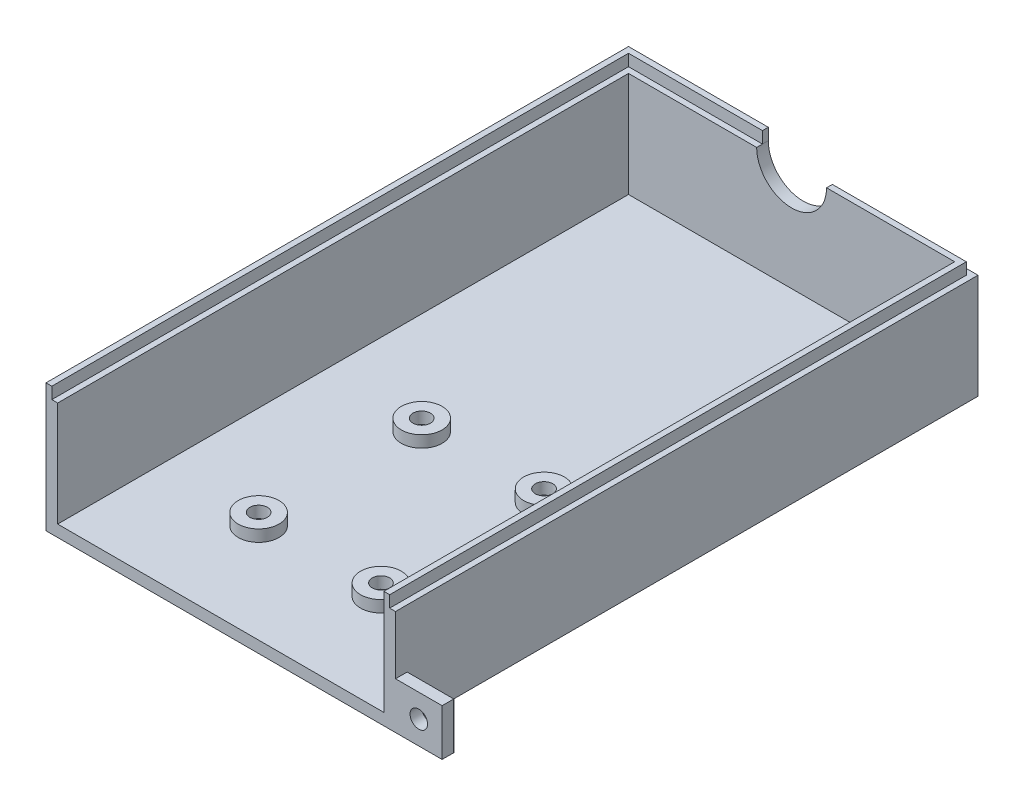
from build123d import *

# Parameters (mm, degrees)
SKETCH3_W           = 60
SKETCH3_H           = 100
BOSS_EXTRUDE1_DEPTH = 40
SHELL1_T            = -2
SKETCH2_R           = 3.5
SKETCH2_R_2         = 1.5
BOSS_EXTRUDE2_DEPTH = 2
CUT_EXTRUDE1_REACH  = 120.322
SKETCH4_W           = 60
SKETCH4_H           = 100
CUT_EXTRUDE2_REACH  = 118.636
SKETCH5_R           = 6
CUT_EXTRUDE3_DEPTH  = 2
BOSS_EXTRUDE3_DEPTH = 2
SKETCH7_W           = 8
SKETCH7_H           = 8
SKETCH7_R           = 1.5
BOSS_EXTRUDE4_DEPTH = 2


with BuildPart() as part:
    # Sketch3 → Boss-Extrude1 (new body)
    with BuildSketch(Plane(origin=(0, 0, 0), x_dir=(1, 0, 0), z_dir=(0, 1, 0))):
        with Locations((30, 50)):
            Rectangle(SKETCH3_W, SKETCH3_H)
    extrude(amount=BOSS_EXTRUDE1_DEPTH)

    # Shell1
    shell1_openings = [part.faces().sort_by_distance(p)[0] for p in [
        (30, 20, 0),
    ]]
    offset(amount=SHELL1_T, openings=shell1_openings, kind=Kind.INTERSECTION)

    # Sketch2 → Boss-Extrude2 (add)
    # profile 1 of 4: a face of its own
    with BuildSketch(Plane(origin=(0, 2, 0), x_dir=(1, 0, 0), z_dir=(0, 1, 0))):
        with Locations((19.5, 45)):
            Circle(SKETCH2_R)
        with Locations((19.5, 45)):
            Circle(SKETCH2_R_2, mode=Mode.SUBTRACT)
    # profile 2 of 4: a face of its own
    with BuildSketch(Plane(origin=(0, 2, 0), x_dir=(1, 0, 0), z_dir=(0, 1, 0))):
        with Locations((40.5, 45)):
            Circle(SKETCH2_R)
        with Locations((40.5, 45)):
            Circle(SKETCH2_R_2, mode=Mode.SUBTRACT)
    # profile 3 of 4: a face of its own
    with BuildSketch(Plane(origin=(0, 2, 0), x_dir=(1, 0, 0), z_dir=(0, 1, 0))):
        with Locations((40.5, 17)):
            Circle(SKETCH2_R)
        with Locations((40.5, 17)):
            Circle(SKETCH2_R_2, mode=Mode.SUBTRACT)
    # profile 4 of 4: a face of its own
    with BuildSketch(Plane(origin=(0, 2, 0), x_dir=(1, 0, 0), z_dir=(0, 1, 0))):
        with Locations((19.5, 17)):
            Circle(SKETCH2_R)
        with Locations((19.5, 17)):
            Circle(SKETCH2_R_2, mode=Mode.SUBTRACT)
    extrude(amount=BOSS_EXTRUDE2_DEPTH)

    # Sketch4 → Cut-Extrude1 (cut, up to next)
    with BuildSketch(Plane(origin=(0, 20, 0), x_dir=(1, 0, 0), z_dir=(0, 1, 0)), mode=Mode.PRIVATE) as cut_extrude1_sk1:
        with Locations((30, 50)):
            Rectangle(SKETCH4_W, SKETCH4_H)
    cut_extrude1_tool1 = extrude(cut_extrude1_sk1.sketch, amount=CUT_EXTRUDE1_REACH, mode=Mode.PRIVATE) & part.part
    add(cut_extrude1_tool1.solids().sort_by_distance((30, 20, -50))[0], mode=Mode.SUBTRACT)

    # Sketch5 → Cut-Extrude2 (cut, up to next)
    with BuildSketch(Plane.XY.offset(-98), mode=Mode.PRIVATE) as cut_extrude2_sk1:
        with Locations((30, 20)):
            Circle(SKETCH5_R)
    cut_extrude2_tool1 = extrude(cut_extrude2_sk1.sketch, amount=-CUT_EXTRUDE2_REACH, mode=Mode.PRIVATE) & part.part
    add(cut_extrude2_tool1.solids().sort_by_distance((30, 20, -98))[0], mode=Mode.SUBTRACT)

    # Sketch6 → Cut-Extrude3 (cut)
    with BuildSketch(Plane(origin=(0, 20, 0), x_dir=(1, 0, 0), z_dir=(0, 1, 0))):
        Polygon((30, 100), (30, 99), (59, 99), (59, 0), (60, 0), (60, 100), align=None)
    extrude(amount=-CUT_EXTRUDE3_DEPTH, mode=Mode.SUBTRACT)

    # Sketch6<3> → Boss-Extrude3 (add)
    with BuildSketch(Plane(origin=(0, 20, 0), x_dir=(1, 0, 0), z_dir=(0, 1, 0))):
        Polygon((24, 99), (24, 100), (0, 100), (0, 0), (1, 0), (1, 99), align=None)
    extrude(amount=BOSS_EXTRUDE3_DEPTH)

    # Sketch7 → Boss-Extrude4 (add)
    with BuildSketch(Plane.XY):
        with Locations((64, 4)):
            Rectangle(SKETCH7_W, SKETCH7_H)
        with Locations((64, 4)):
            Circle(SKETCH7_R, mode=Mode.SUBTRACT)
    extrude(amount=-BOSS_EXTRUDE4_DEPTH)


solid = part.part
